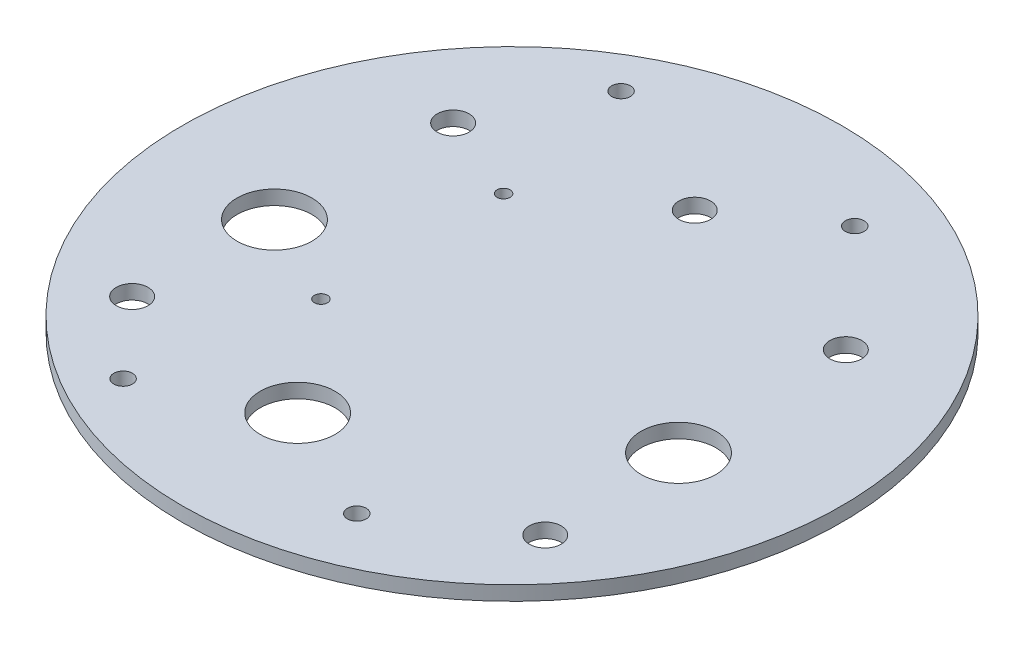
from build123d import *

# Parameters (mm, degrees)
SKETCH1_R                            = 69.85
BOSS_EXTRUDE1_DEPTH                  = 3.048
F_17_64_0_26563_DIAMETER_HOLE1_D     = 6.747002
F_17_64_0_26563_DIAMETER_HOLE1_DEPTH = 16.51
F_17_64_0_26563_DIAMETER_HOLE1_TIP   = 2.027003899
F_5_32_0_15625_DIAMETER_HOLE1_D      = 3.96875
F_5_32_0_15625_DIAMETER_HOLE1_DEPTH  = 16.51
F_5_32_0_15625_DIAMETER_HOLE1_TIP    = 1.192332791
F_5_8_0_625_DIAMETER_HOLE1_D         = 15.875
F_5_8_0_625_DIAMETER_HOLE1_DEPTH     = 16.51
F_5_8_0_625_DIAMETER_HOLE1_TIP       = 4.769331164
F_7_64_0_10938_DIAMETER_HOLE1_D      = 2.778252
F_7_64_0_10938_DIAMETER_HOLE1_DEPTH  = 16.51
F_7_64_0_10938_DIAMETER_HOLE1_TIP    = 0.834671108


with BuildPart() as part:
    # Sketch1 → Boss-Extrude1 (new body)
    with BuildSketch(Plane(origin=(0, 0, 0), x_dir=(1, 0, 0), z_dir=(0, 1, 0))):
        with Locations(Location((0, 0, 0), (0, 0, 90))):
            Circle(SKETCH1_R)
    extrude(amount=BOSS_EXTRUDE1_DEPTH)

    # 17/64 (0.26563) Diameter Hole1
    with Locations(Plane(origin=(-43.779439924, 0, 36.735311894), x_dir=(0, 0, -1), z_dir=(0, -1, 0))):
        with Locations((0, 0), (0, 87.558879848), (65.872994861, 85.392363774), (65.872994861, 2.166516074), (75.470311894, 43.779439924)):
            Hole(F_17_64_0_26563_DIAMETER_HOLE1_D / 2, depth=F_17_64_0_26563_DIAMETER_HOLE1_DEPTH)
            with Locations((0, 0, -(F_17_64_0_26563_DIAMETER_HOLE1_DEPTH + F_17_64_0_26563_DIAMETER_HOLE1_TIP / 2))):  # 118° drill point
                Cone(0, F_17_64_0_26563_DIAMETER_HOLE1_D / 2, F_17_64_0_26563_DIAMETER_HOLE1_TIP, mode=Mode.SUBTRACT)

    # 5/32 (0.15625) Diameter Hole1
    with Locations(Plane(origin=(-29.6545, 0, 52.7685), x_dir=(0, 0, -1), z_dir=(0, -1, 0))):
        with Locations((0, 0), (0, 49.53), (105.537, 49.53), (105.537, 0)):
            Hole(F_5_32_0_15625_DIAMETER_HOLE1_D / 2, depth=F_5_32_0_15625_DIAMETER_HOLE1_DEPTH)
            with Locations((0, 0, -(F_5_32_0_15625_DIAMETER_HOLE1_DEPTH + F_5_32_0_15625_DIAMETER_HOLE1_TIP / 2))):  # 118° drill point
                Cone(0, F_5_32_0_15625_DIAMETER_HOLE1_D / 2, F_5_32_0_15625_DIAMETER_HOLE1_TIP, mode=Mode.SUBTRACT)

    # 5/8 (0.625) Diameter Hole1
    with Locations(Plane(origin=(-42.818743744, 0, 7.525311894), x_dir=(0, 0, -1), z_dir=(0, -1, 0))):
        with Locations((0, 0), (-33.02, 37.929243744), (0, 85.637487488)):
            Hole(F_5_8_0_625_DIAMETER_HOLE1_D / 2, depth=F_5_8_0_625_DIAMETER_HOLE1_DEPTH)
            with Locations((0, 0, -(F_5_8_0_625_DIAMETER_HOLE1_DEPTH + F_5_8_0_625_DIAMETER_HOLE1_TIP / 2))):  # 118° drill point
                Cone(0, F_5_8_0_625_DIAMETER_HOLE1_D / 2, F_5_8_0_625_DIAMETER_HOLE1_TIP, mode=Mode.SUBTRACT)

    # 7/64 (0.10938) Diameter Hole1
    with Locations(Plane(origin=(-23.3045, 0, 17.182317033), x_dir=(0, 0, -1), z_dir=(0, -1, 0))):
        with Locations((0, 0), (38.7, 0)):
            Hole(F_7_64_0_10938_DIAMETER_HOLE1_D / 2, depth=F_7_64_0_10938_DIAMETER_HOLE1_DEPTH)
            with Locations((0, 0, -(F_7_64_0_10938_DIAMETER_HOLE1_DEPTH + F_7_64_0_10938_DIAMETER_HOLE1_TIP / 2))):  # 118° drill point
                Cone(0, F_7_64_0_10938_DIAMETER_HOLE1_D / 2, F_7_64_0_10938_DIAMETER_HOLE1_TIP, mode=Mode.SUBTRACT)


solid = part.part
